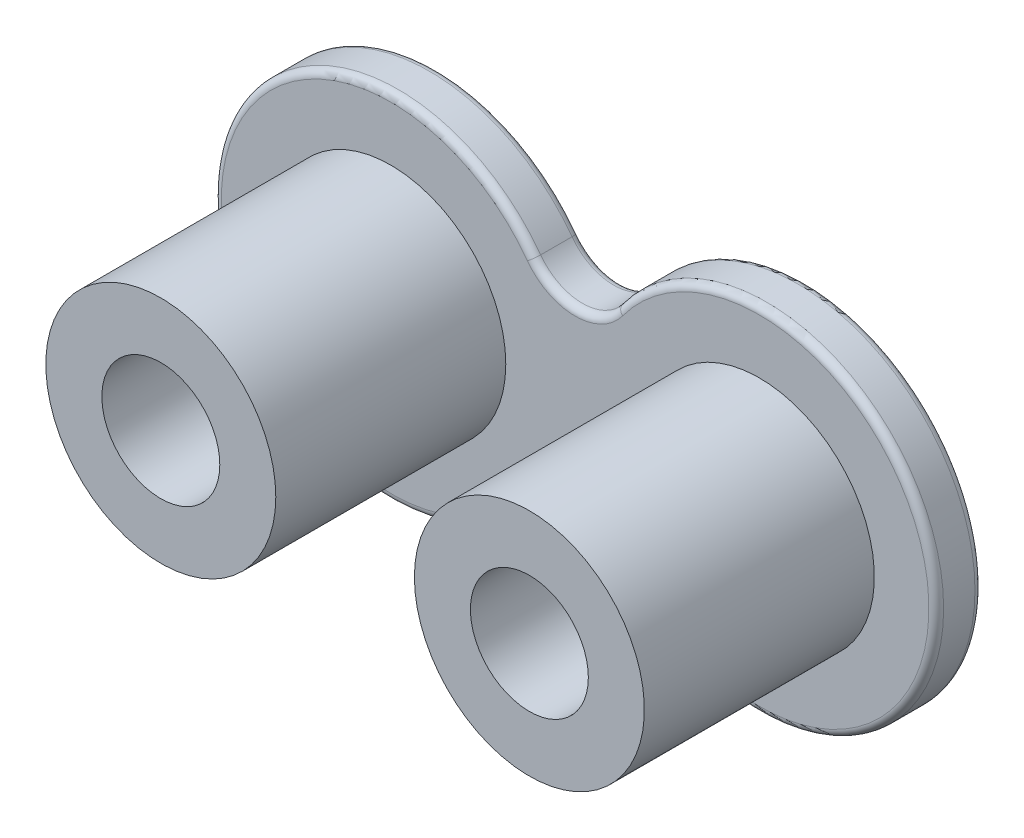
from build123d import *

# Parameters (mm, degrees)
SKETCH1_R           = 2.032
BOSS_EXTRUDE1_DEPTH = 1.5875
FILLET1_R           = 0.254
SKETCH5_R           = 3.9624
SKETCH5_R_2         = 2.032
BOSS_EXTRUDE3_DEPTH = 7.9248


with BuildPart() as part:
    # Sketch1 → Boss-Extrude1 (new body)
    with BuildSketch(Plane.XY):
        with BuildLine():
            ThreePointArc((-1.438730062, 3.61118313), (-12.446, 0), (-1.438730062, -3.61118313))
            ThreePointArc((-1.438730062, -3.61118313), (0, -2.883269418), (1.438730062, -3.61118313))
            ThreePointArc((1.438730062, -3.61118313), (12.446, 0), (1.438730062, 3.61118313))
            ThreePointArc((1.438730062, 3.61118313), (0, 2.883269418), (-1.438730062, 3.61118313))
        make_face()
        with Locations((-6.35, 0)):
            Circle(SKETCH1_R, mode=Mode.SUBTRACT)
        with Locations(Location((6.35, 0, 0), (0, 0, 180))):
            Circle(SKETCH1_R, mode=Mode.SUBTRACT)
    extrude(amount=BOSS_EXTRUDE1_DEPTH)

    # Fillet1
    fillet1_edges = [part.edges().sort_by_distance(p)[0] for p in [
        (-8.382, 0, 0),
        (-8.382, 0, 1.5875),
        (0, -2.883269418, 1.5875),
        (8.382, 0, 0),
        (8.382, 0, 1.5875),
        (12.446, 0, 1.5875),
        (0, 2.883269418, 1.5875),
        (12.446, 0, 0),
        (0, -2.883269418, 0),
        (-12.446, 0, 0),
        (0, 2.883269418, 0),
        (-12.446, 0, 1.5875),
    ]]
    fillet(fillet1_edges, radius=FILLET1_R)

    # Sketch5 → Boss-Extrude3 (add)
    # profile 1 of 2: a face of its own
    with BuildSketch(Plane.XY.offset(1.5875)):
        with Locations((-6.35, 0)):
            Circle(SKETCH5_R)
        with Locations((-6.35, 0)):
            Circle(SKETCH5_R_2, mode=Mode.SUBTRACT)
    # profile 2 of 2: a face of its own
    with BuildSketch(Plane.XY.offset(1.5875)):
        with Locations(Location((6.35, 0, 0), (0, 0, 180))):
            Circle(SKETCH5_R)
        with Locations((6.35, 0)):
            Circle(SKETCH5_R_2, mode=Mode.SUBTRACT)
    extrude(amount=BOSS_EXTRUDE3_DEPTH)


solid = part.part
